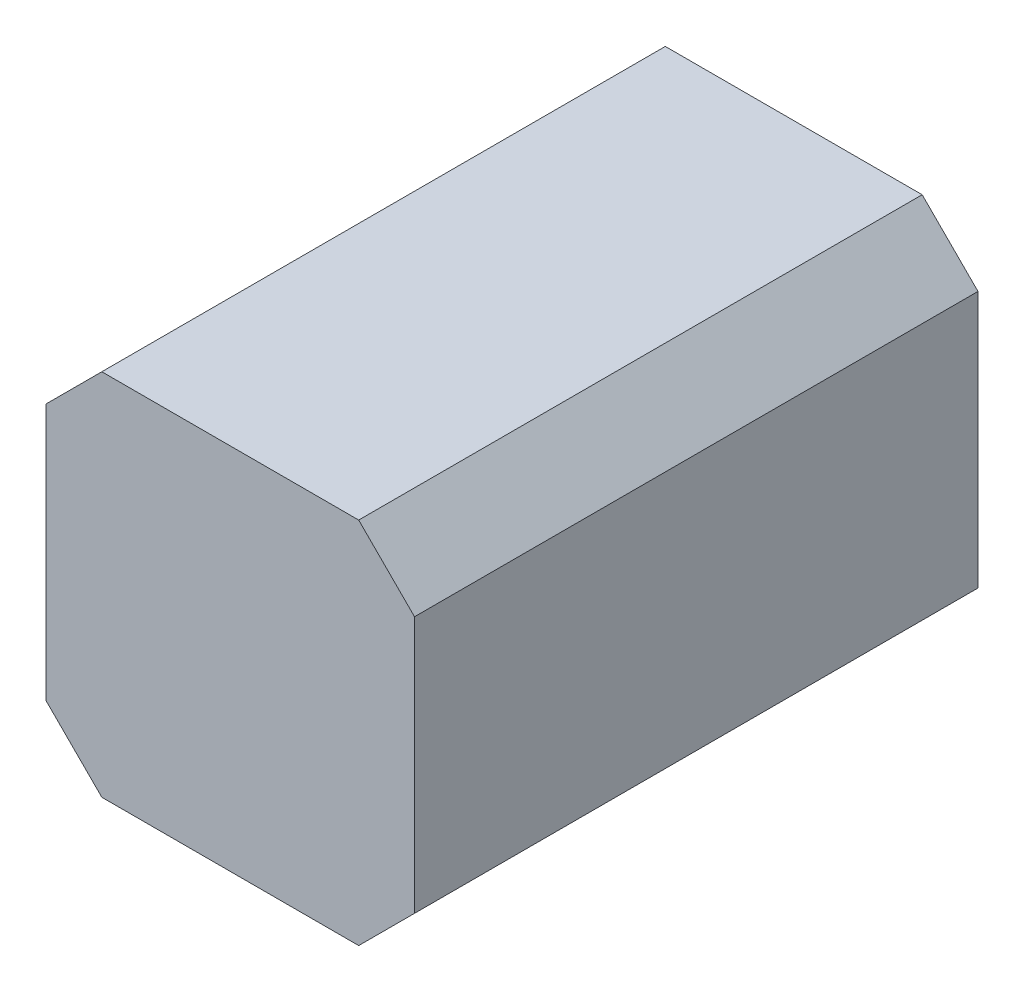
from build123d import *

# Parameters (mm, degrees)
EXTRUDE_2_DEPTH = 237


with BuildPart() as part:
    # 草图3 → 凸台-拉伸2 (new body)
    with BuildSketch(Plane.XY):
        Polygon((-77.5, -54.021861301), (-54.021861301, -77.5), (54.021861301, -77.5), (77.5, -54.021861301), (77.5, 54.021861301), (54.021861301, 77.5), (-54.021861301, 77.5), (-77.5, 54.021861301), align=None)
    extrude(amount=EXTRUDE_2_DEPTH)


solid = part.part
